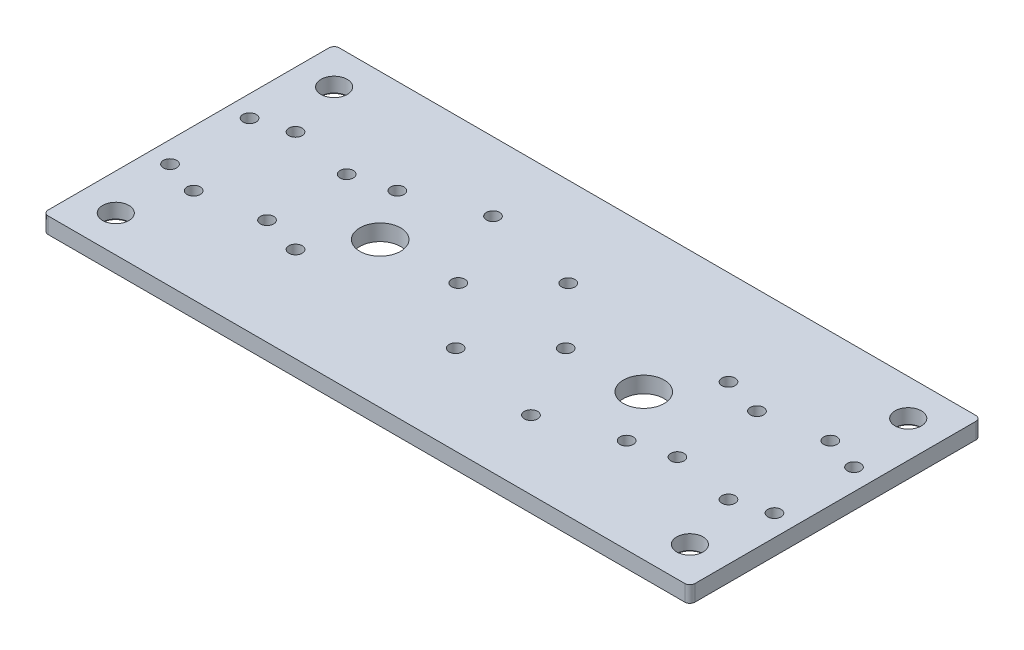
from build123d import *

# Parameters (mm, degrees)
SKETCH1_W                         = 254
SKETCH1_H                         = 114.3
BOSS_EXTRUDE1_DEPTH               = 6.35
M3_CLEARANCE_HOLE1_D              = 5.2
F_3_8_CLEARANCE_HOLE1_D           = 10.31748
F_3_8_CLEARANCE_HOLE1_CSINK_D     = 11.58748
F_3_8_CLEARANCE_HOLE1_CSINK_ANGLE = 90
M3_CLEARANCE_HOLE2_D              = 5.2
FILLET1_R                         = 2
M3_CLEARANCE_HOLE4_D              = 5.2
SKETCH18_R                        = 8
CUT_EXTRUDE1_DEPTH                = 140.411064841


with BuildPart() as part:
    # Sketch1 → Boss-Extrude1 (new body)
    with BuildSketch(Plane(origin=(0, 0, 0), x_dir=(1, 0, 0), z_dir=(0, 1, 0))):
        Rectangle(SKETCH1_W, SKETCH1_H)
    extrude(amount=BOSS_EXTRUDE1_DEPTH)

    # M3 Clearance Hole1 (through all)
    with Locations(Plane(origin=(0, 6.35, 0), x_dir=(1, 0, 0), z_dir=(0, 1, 0))):
        with Locations((-80.5625, -15.621), (-80.5625, 15.621), (-118.6625, -15.621), (-118.6625, 15.621), (118.6625, -15.621), (80.5625, -15.621), (80.5625, 15.621), (118.6625, 15.621)):
            Hole(M3_CLEARANCE_HOLE1_D / 2)

    # 3/8 Clearance Hole1 (through all)
    with Locations(Plane(origin=(0, 0, 0), x_dir=(-1, 0, 0), z_dir=(0, -1, 0))):
        with Locations((-112.7125, 42.8625), (-112.7125, -42.8625), (112.7125, -42.8625), (112.7125, 42.8625)):
            CounterSinkHole(F_3_8_CLEARANCE_HOLE1_D / 2, F_3_8_CLEARANCE_HOLE1_CSINK_D / 2, counter_sink_angle=F_3_8_CLEARANCE_HOLE1_CSINK_ANGLE)

    # M3 Clearance Hole2 (through all)
    with Locations(Plane.XZ):
        with Locations((105, 20), (65, -20), (105, -20), (65, 20), (-65, -20), (-65, 20), (-105, 20), (-105, -20)):
            Hole(M3_CLEARANCE_HOLE2_D / 2)

    # Fillet1
    fillet1_edges = [part.edges().sort_by_distance(p)[0] for p in [
        (-127, 3.175, -57.15),
        (127, 3.175, -57.15),
        (127, 3.175, 57.15),
        (-127, 3.175, 57.15),
    ]]
    fillet(fillet1_edges, radius=FILLET1_R)

    # M3 Clearance Hole4 (through all)
    with Locations(Plane.XZ):
        with Locations((0, -22.1), (-21.65, -0.55), (-37.55, -30.1), (37.55, 30.1), (21.65, 0.55), (0, 22.1)):
            Hole(M3_CLEARANCE_HOLE4_D / 2)

    # Sketch18 → Cut-Extrude1 (cut, through all)
    with BuildSketch(Plane.XZ):
        with Locations(Location((-51.75, 0, 0), (0, 0, 270))):
            Circle(SKETCH18_R)
        with Locations(Location((51.75, 0, 0), (0, 0, 90))):
            Circle(SKETCH18_R)
    extrude(amount=-CUT_EXTRUDE1_DEPTH, mode=Mode.SUBTRACT)


solid = part.part
